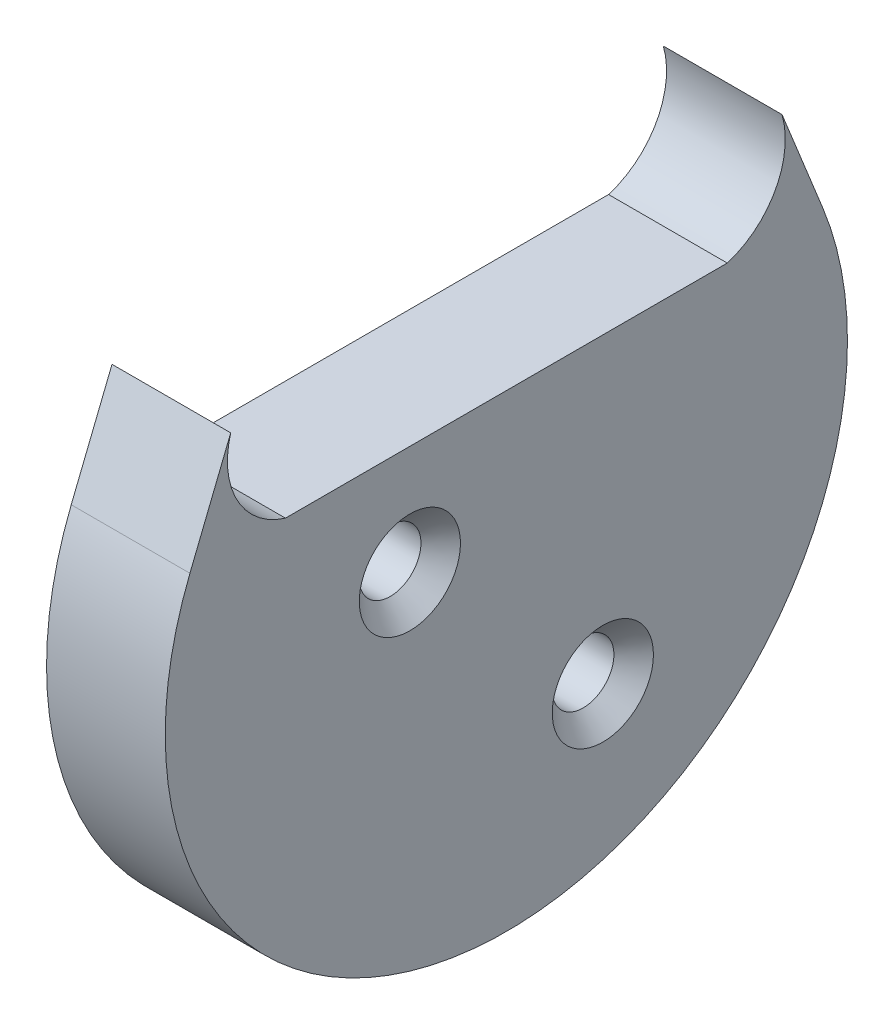
from build123d import *

# Parameters (mm, degrees)
BOSS_EXTRUDE1_DEPTH             = 2.175
F_2_CLEARANCE_HOLE2_D           = 2.2606
F_2_CLEARANCE_HOLE2_CSINK_D     = 3.7084
F_2_CLEARANCE_HOLE2_CSINK_ANGLE = 90


with BuildPart() as part:
    # Sketch1 → Boss-Extrude1 (new, symmetric)
    with BuildSketch(Plane(origin=(0, 0, 0), x_dir=(0, 0, -1), z_dir=(1, 0, 0))):
        with BuildLine():
            Line((-10.101597565, 8.379005111), (-11.5955, 4.668445111))
            ThreePointArc((-11.5955, 4.668445111), (0, -12.5), (11.5955, 4.668445111))
            Line((11.5955, 4.668445111), (10.101597565, 8.379005111))
            ThreePointArc((10.101597565, 8.379005111), (9.860779562, 6.11162847), (8.0955, 4.668445111))
            Line((8.0955, 4.668445111), (-8.0955, 4.668445111))
            ThreePointArc((-8.0955, 4.668445111), (-9.860779562, 6.11162847), (-10.101597565, 8.379005111))
        make_face()
    extrude(amount=BOSS_EXTRUDE1_DEPTH, both=True)

    # #2 Clearance Hole2 (through all)
    with Locations(Plane(origin=(2.175, 0.668445111, 3.535533906), x_dir=(0, 0, 1), z_dir=(1, 0, 0))):
        with Locations((0, 0), (-7.071067812, 7.071067812)):
            CounterSinkHole(F_2_CLEARANCE_HOLE2_D / 2, F_2_CLEARANCE_HOLE2_CSINK_D / 2, counter_sink_angle=F_2_CLEARANCE_HOLE2_CSINK_ANGLE)


solid = part.part
